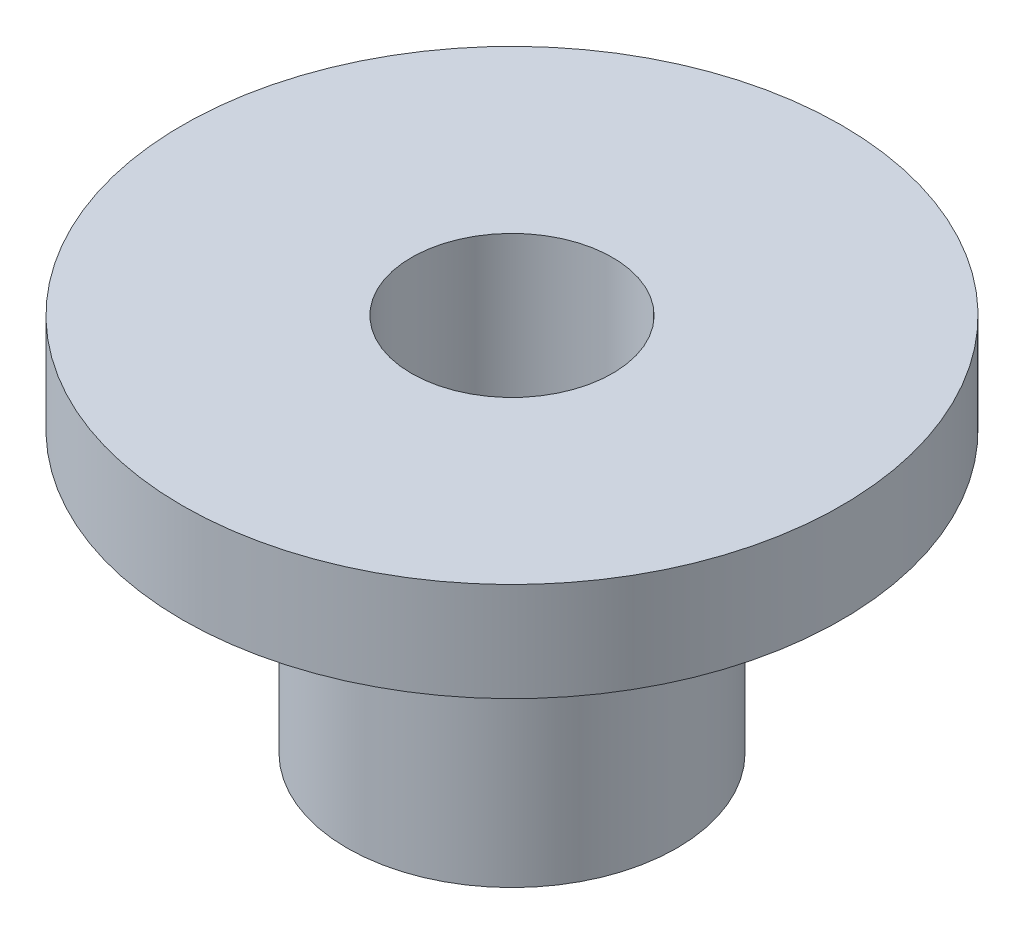
from build123d import *

# Parameters (mm, degrees)
SKETCH_1_R      = 5
SKETCH_1_R_2    = 3.05
EXTRUDE_1_DEPTH = 8.5
SKETCH_2_R      = 10
SKETCH_2_R_2    = 3.05
EXTRUDE_2_DEPTH = 3


with BuildPart() as part:
    # 草图1 → 凸台-拉伸1 (new body)
    with BuildSketch(Plane(origin=(0, 0, 0), x_dir=(1, 0, 0), z_dir=(0, 1, 0))):
        with Locations(Location((0, 0, 0), (0, 0, 270))):
            Circle(SKETCH_1_R)
        with Locations(Location((0, 0, 0), (0, 0, 270))):
            Circle(SKETCH_1_R_2, mode=Mode.SUBTRACT)
    extrude(amount=EXTRUDE_1_DEPTH)

    # 草图2 → 凸台-拉伸2 (add)
    with BuildSketch(Plane(origin=(0, 8.5, 0), x_dir=(1, 0, 0), z_dir=(0, 1, 0))):
        with Locations(Location((0, 0, 0), (0, 0, 270))):
            Circle(SKETCH_2_R)
        with Locations(Location((0, 0, 0), (0, 0, 270))):
            Circle(SKETCH_2_R_2, mode=Mode.SUBTRACT)
    extrude(amount=EXTRUDE_2_DEPTH)


solid = part.part
